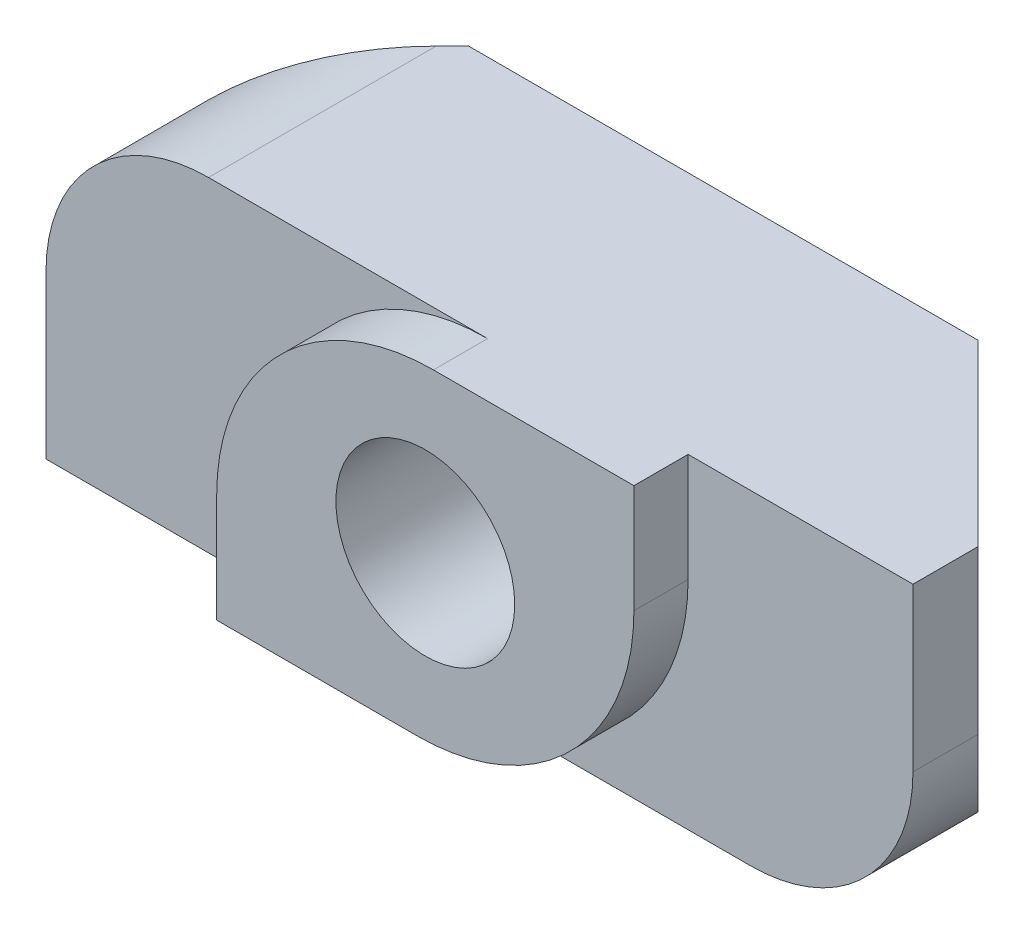
from build123d import *

# Parameters (mm, degrees)
BOSS_EXTRUDE1_DEPTH = 6
SKETCH2_R           = 1.65
CUT_EXTRUDE1_DEPTH  = 12.412712211
FILLET1_R           = 4
FILLET2_R           = 3


with BuildPart() as part:
    # Sketch1 → Boss-Extrude1 (new body)
    with BuildSketch(Plane(origin=(0, 0, 0), x_dir=(1, 0, 0), z_dir=(0, 1, 0))):
        Polygon((4.7, 0), (-4.7, 0), (-8, -3.3), (-8, -4.5), (-3.85, -4.5), (-3.85, -5.5), (3.85, -5.5), (3.85, -4.5), (8, -4.5), (8, -3.3), align=None)
    extrude(amount=BOSS_EXTRUDE1_DEPTH)

    # Sketch2 → Cut-Extrude1 (cut, through all)
    with BuildSketch(Plane.XY.offset(5.5)):
        with Locations((0, 3)):
            Circle(SKETCH2_R)
    extrude(amount=-CUT_EXTRUDE1_DEPTH, mode=Mode.SUBTRACT)

    # Fillet1
    fillet1_edges = [part.edges().sort_by_distance(p)[0] for p in [
        (3.85, 0, 5),
        (-3.85, 6, 5),
    ]]
    fillet(fillet1_edges, radius=FILLET1_R)

    # Fillet2
    fillet2_edges = [part.edges().sort_by_distance(p)[0] for p in [
        (8, 0, 3.9),
        (-8, 6, 3.9),
    ]]
    fillet(fillet2_edges, radius=FILLET2_R)


solid = part.part
